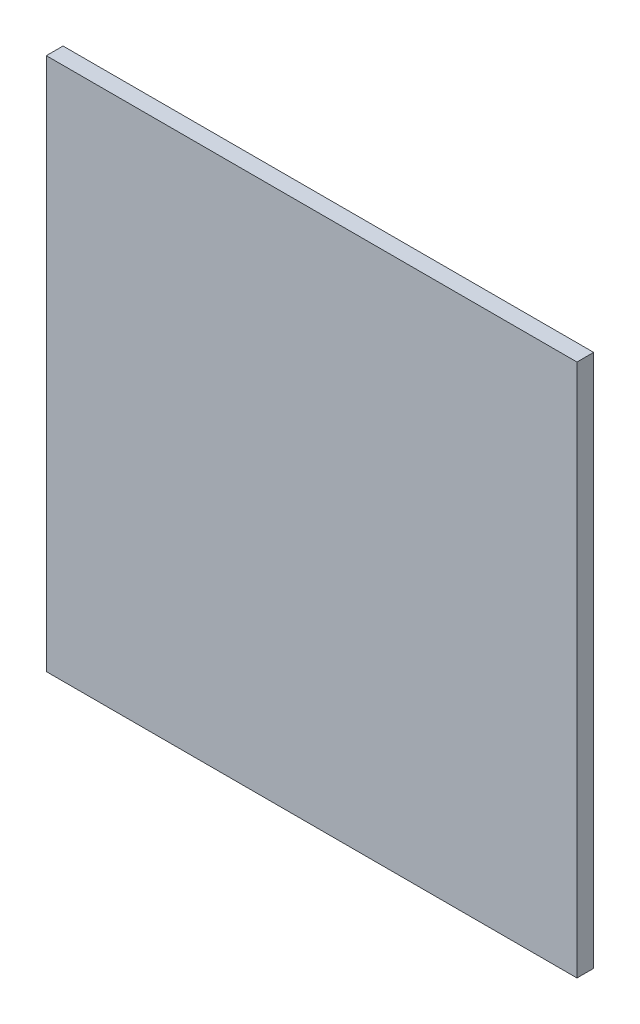
from build123d import *

# Parameters (mm, degrees)
SKETCH2_W           = 95.198145292
SKETCH2_H           = 95.701839182
BOSS_EXTRUDE1_DEPTH = 3


with BuildPart() as part:
    # Sketch2 → Boss-Extrude1 (new body)
    with BuildSketch(Plane.XY):
        with Locations((7.051714466, -23.799536323)):
            Rectangle(SKETCH2_W, SKETCH2_H)
    extrude(amount=BOSS_EXTRUDE1_DEPTH)


solid = part.part
